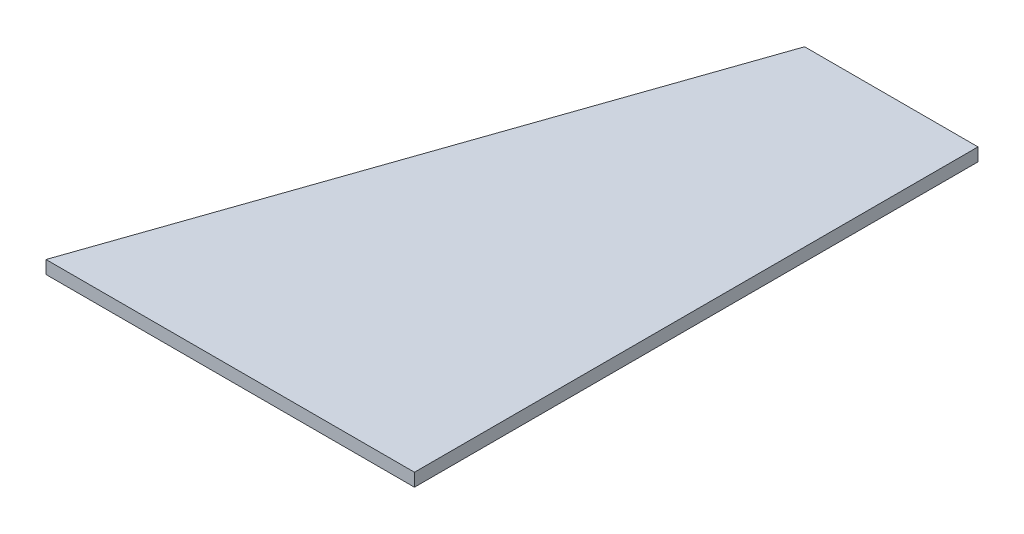
from build123d import *

# Parameters (mm, degrees)
BOSS_EXTRUDE1_DEPTH = 3


with BuildPart() as part:
    # Sketch1 → Boss-Extrude1 (new, symmetric)
    with BuildSketch(Plane(origin=(0, 0, 0), x_dir=(1, 0, 0), z_dir=(0, 1, 0))):
        Polygon((170, 260), (90, 260), (0, 0), (170, 0), align=None)
    extrude(amount=BOSS_EXTRUDE1_DEPTH, both=True)


solid = part.part
